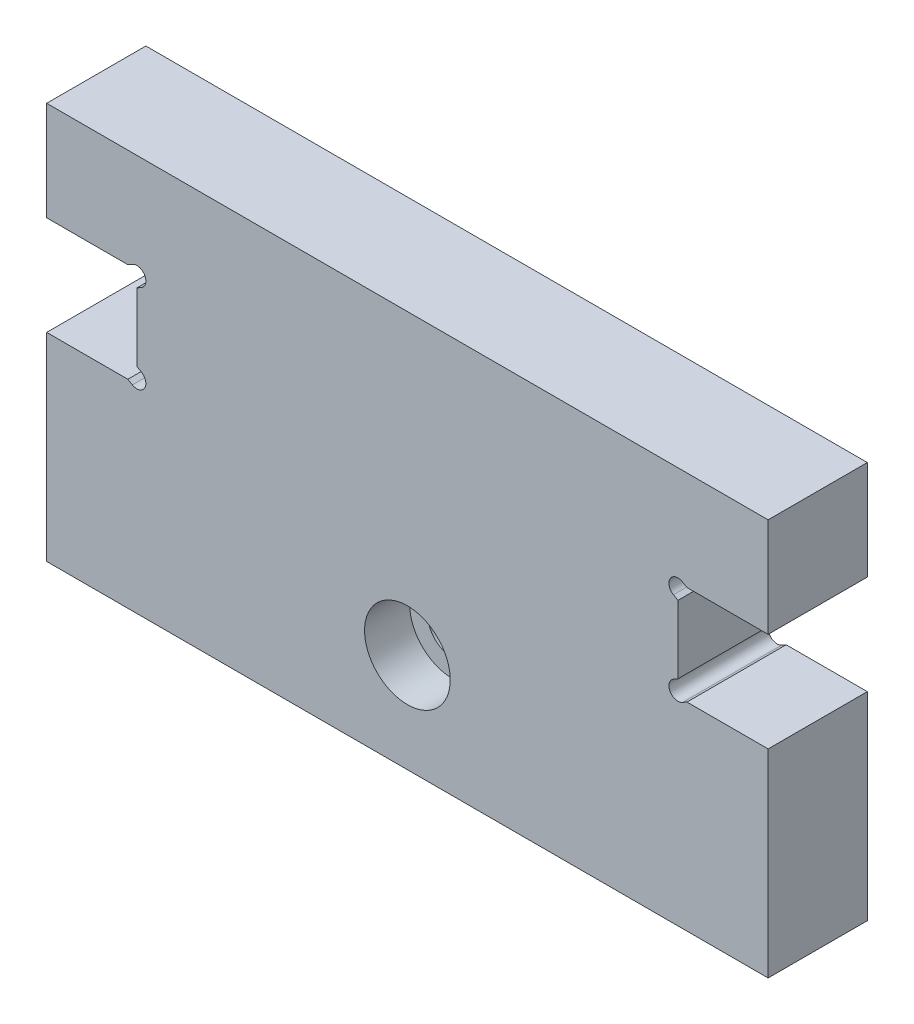
from build123d import *

# Parameters (mm, degrees)
BOSS_EXTRUDE1_DEPTH = 11
SKETCH2_R           = 4.75
CUT_EXTRUDE1_DEPTH  = 5
CUT_EXTRUDE2_START  = -5
SKETCH2_3_R         = 2.75
CUT_EXTRUDE2_DEPTH  = 87.961948653


with BuildPart() as part:
    # Profile → Boss-Extrude1 (new body)
    with BuildSketch(Plane.XY):
        with BuildLine():
            Line((0, 33), (9, 33))
            Line((9, 33), (9.5, 33.288675135))
            ThreePointArc((9.5, 33.288675135), (10.866025404, 32.922649731), (10.5, 31.556624327))
            Line((10.5, 31.556624327), (10, 31.267949192))
            Line((10, 31.267949192), (10, 23.732050808))
            Line((10, 23.732050808), (10.5, 23.443375673))
            ThreePointArc((10.5, 23.443375673), (10.866025404, 22.077350269), (9.5, 21.711324865))
            Line((9.5, 21.711324865), (9, 22))
            Line((9, 22), (0, 22))
            Line((0, 22), (0, 0))
            Line((0, 0), (80, 0))
            Line((80, 0), (80, 22))
            Line((80, 22), (71, 22))
            Line((71, 22), (70.5, 21.711324865))
            ThreePointArc((70.5, 21.711324865), (69.133974596, 22.077350269), (69.5, 23.443375673))
            Line((69.5, 23.443375673), (70, 23.732050808))
            Line((70, 23.732050808), (70, 31.267949192))
            Line((70, 31.267949192), (69.5, 31.556624327))
            ThreePointArc((69.5, 31.556624327), (69.133974596, 32.922649731), (70.5, 33.288675135))
            Line((70.5, 33.288675135), (71, 33))
            Line((71, 33), (80, 33))
            Line((80, 33), (80, 44))
            Line((80, 44), (0, 44))
            Line((0, 44), (0, 33))
        make_face()
    extrude(amount=BOSS_EXTRUDE1_DEPTH)

    # Sketch2 → Cut-Extrude1 (cut)
    with BuildSketch(Plane.XY.offset(11)):
        with Locations((40, 11)):
            Circle(SKETCH2_R)
    extrude(amount=-CUT_EXTRUDE1_DEPTH, mode=Mode.SUBTRACT)

    # Sketch2<3> → Cut-Extrude2 (cut, through all)
    with BuildSketch(Plane.XY.offset(11).offset(CUT_EXTRUDE2_START)):
        with Locations((40, 11)):
            Circle(SKETCH2_3_R)
    extrude(amount=-CUT_EXTRUDE2_DEPTH, mode=Mode.SUBTRACT)


solid = part.part
